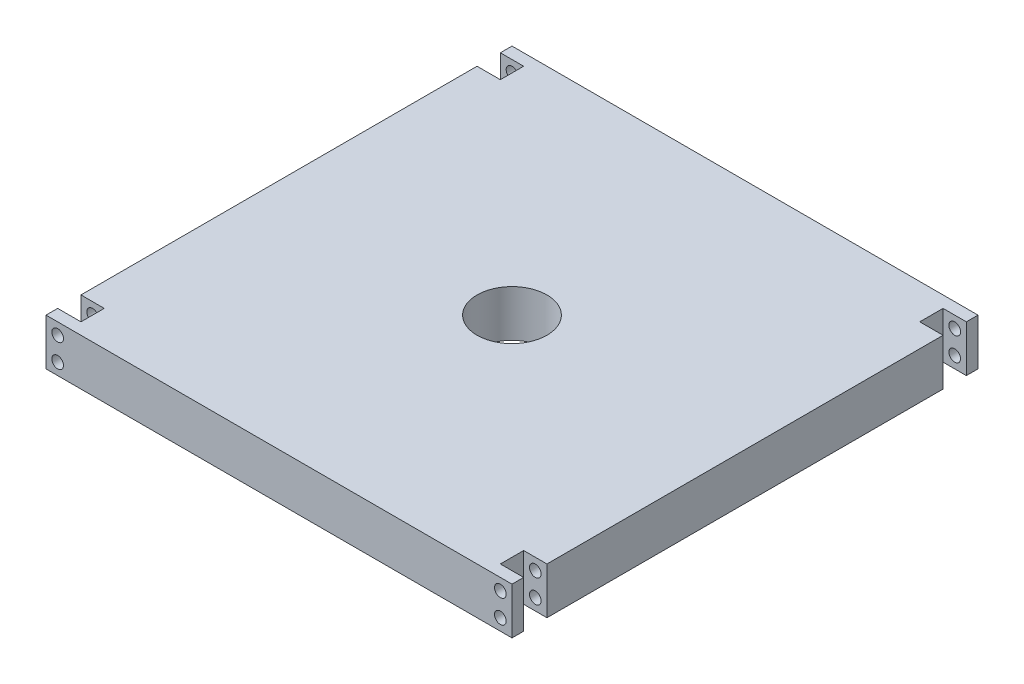
from build123d import *

# Parameters (mm, degrees)
ESQUISSE1_R             = 15
BASE_DEPTH              = 20
ESQUISSE2_R             = 2.5
ENL_V_MAT_EXTRU_1_DEPTH = 225.499443206


with BuildPart() as part:
    # Esquisse1 → BASE (new body)
    with BuildSketch(Plane(origin=(0, 0, 0), x_dir=(1, 0, 0), z_dir=(0, 1, 0))):
        Polygon((-100, 95), (-90, 95), (-90, 85), (-100, 85), (-100, -85), (-90, -85), (-90, -95), (-100, -95), (-100, -100), (100, -100), (100, -95), (90, -95), (90, -85), (100, -85), (100, 85), (90, 85), (90, 95), (100, 95), (100, 100), (-100, 100), align=None)
        with Locations(Location((0, 0, 0), (0, 0, 270))):
            Circle(ESQUISSE1_R, mode=Mode.SUBTRACT)
    extrude(amount=BASE_DEPTH)

    # Esquisse2 → Enlèv. mat.-Extru.1 (cut, through all)
    with BuildSketch(Plane.XY.offset(100)):
        with Locations((-95, 15)):
            Circle(ESQUISSE2_R)
        with Locations((-95, 5)):
            Circle(ESQUISSE2_R)
        with Locations(Location((95, 5, 0), (0, 0, 180))):
            Circle(ESQUISSE2_R)
        with Locations(Location((95, 15, 0), (0, 0, 180))):
            Circle(ESQUISSE2_R)
    extrude(amount=-ENL_V_MAT_EXTRU_1_DEPTH, mode=Mode.SUBTRACT)


solid = part.part
